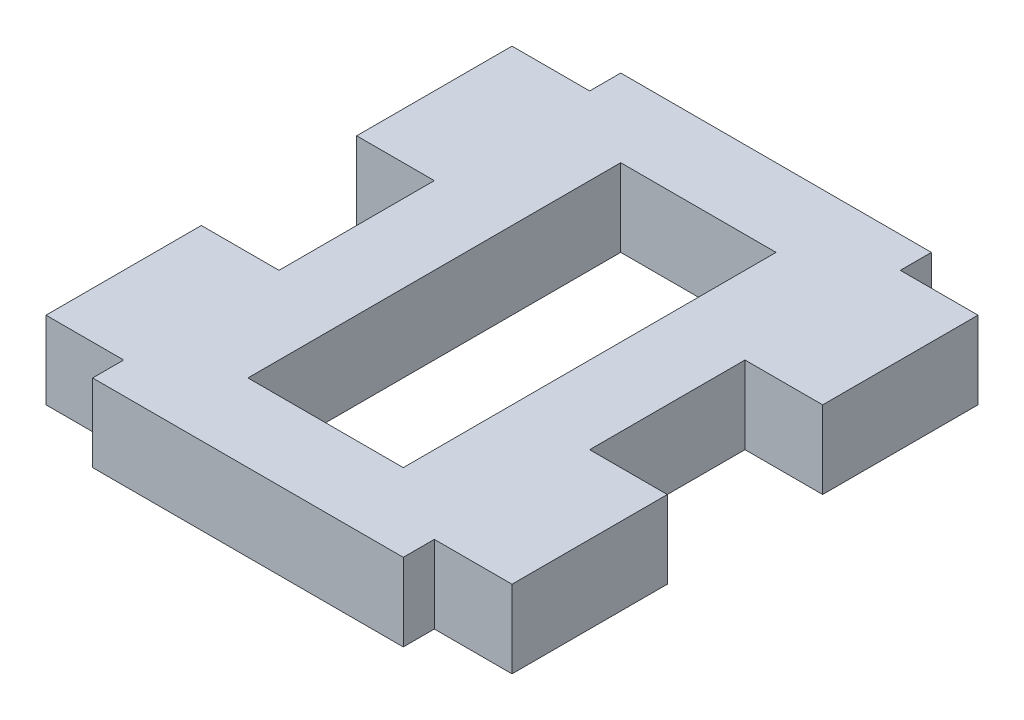
from build123d import *

# Parameters (mm, degrees)
SKETCH1_W           = 25.4
SKETCH1_H           = 43.18
BOSS_EXTRUDE1_DEPTH = 6.35
SKETCH2_W           = 6.35
SKETCH2_H           = 12.7
BOSS_EXTRUDE2_DEPTH = 6.35
SKETCH3_W           = 12.7
SKETCH3_H           = 30.48
CUT_EXTRUDE1_DEPTH  = 30.484794386


with BuildPart() as part:
    # Sketch1 → Boss-Extrude1 (new body)
    with BuildSketch(Plane(origin=(0, 0, 0), x_dir=(1, 0, 0), z_dir=(0, 1, 0))):
        Rectangle(SKETCH1_W, SKETCH1_H)
    extrude(amount=BOSS_EXTRUDE1_DEPTH)

    # Sketch2 → Boss-Extrude2 (add)
    with BuildSketch(Plane.XZ):
        with Locations((-15.875, 12.7)):
            Rectangle(SKETCH2_W, SKETCH2_H)
        with Locations((15.875, 12.7)):
            Rectangle(SKETCH2_W, SKETCH2_H)
        with Locations((15.875, -12.7)):
            Rectangle(SKETCH2_W, SKETCH2_H)
        with Locations((-15.875, -12.7)):
            Rectangle(SKETCH2_W, SKETCH2_H)
    extrude(amount=-BOSS_EXTRUDE2_DEPTH)

    # Sketch3 → Cut-Extrude1 (cut, through all)
    with BuildSketch(Plane.XZ):
        Rectangle(SKETCH3_W, SKETCH3_H)
    extrude(amount=-CUT_EXTRUDE1_DEPTH, mode=Mode.SUBTRACT)


solid = part.part
